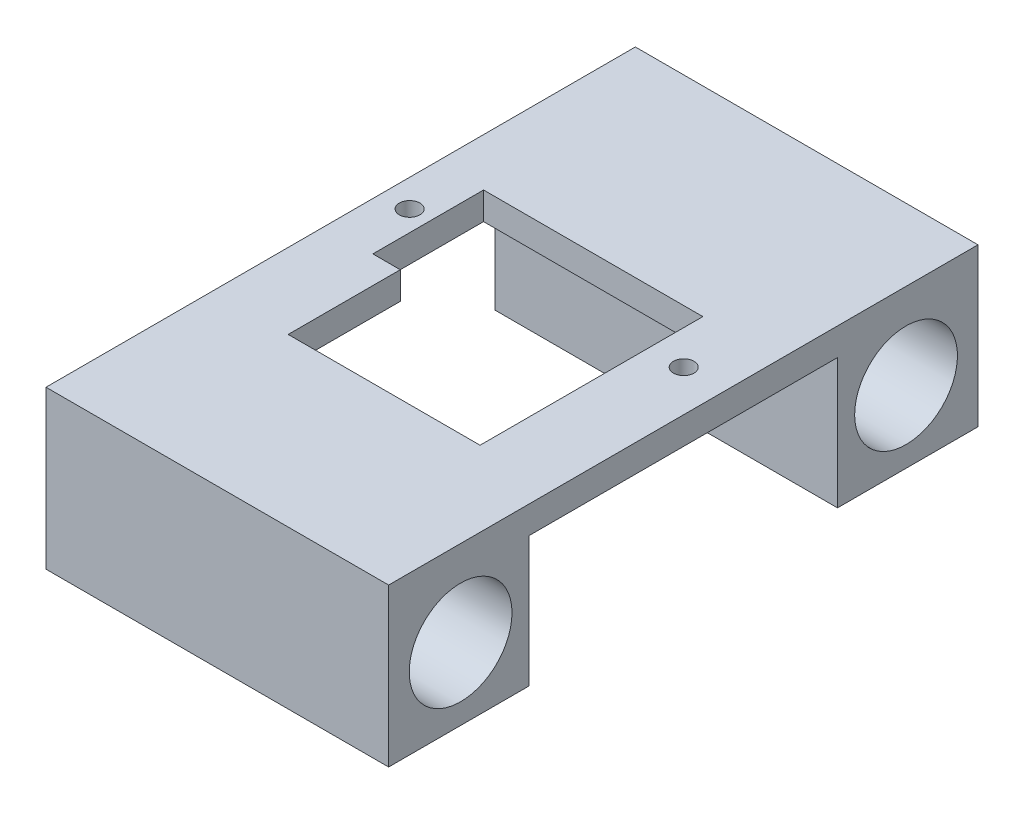
from build123d import *

# Parameters (mm, degrees)
SKETCH1_R           = 7.5
BOSS_EXTRUDE1_DEPTH = 25
CUT_EXTRUDE1_DEPTH  = 34
SKETCH3_W           = 45
SKETCH3_H           = 19
CUT_EXTRUDE2_DEPTH  = 62
SKETCH4_R           = 1.5
CUT_EXTRUDE3_DEPTH  = 62


with BuildPart() as part:
    # Sketch1 → Boss-Extrude1 (new, symmetric)
    with BuildSketch(Plane(origin=(0, 0, 0), x_dir=(0, 0, -1), z_dir=(1, 0, 0))):
        Polygon((-32.5, -10.5), (-43, -10.5), (-43, 12.5), (43, 12.5), (43, -10.5), align=None)
        with Locations((-32.5, 0)):
            Circle(SKETCH1_R, mode=Mode.SUBTRACT)
        with Locations(Location((32.5, 0, 0), (0, 0, 180))):
            Circle(SKETCH1_R, mode=Mode.SUBTRACT)
    extrude(amount=BOSS_EXTRUDE1_DEPTH, both=True)

    # Sketch2 → Cut-Extrude1 (cut)
    with BuildSketch(Plane.XZ.offset(10.5)):
        Polygon((14, -13.850798543), (-18, -13.850798543), (-18, 2.304286058), (-14, 2.304286058), (-14, 18.660685655), (14, 18.660685655), align=None)
    extrude(amount=-CUT_EXTRUDE1_DEPTH, mode=Mode.SUBTRACT)

    # Sketch3 → Cut-Extrude2 (cut)
    with BuildSketch(Plane.ZY.offset(25)):
        with Locations((0, -1)):
            Rectangle(SKETCH3_W, SKETCH3_H)
    extrude(amount=-CUT_EXTRUDE2_DEPTH, mode=Mode.SUBTRACT)

    # Sketch4 → Cut-Extrude3 (cut)
    with BuildSketch(Plane.XZ.offset(-8.5)):
        with Locations(Location((-21, -6.058605683, 0), (0, 0, 270))):
            Circle(SKETCH4_R)
        with Locations(Location((19, -6.058605683, 0), (0, 0, 270))):
            Circle(SKETCH4_R)
    extrude(amount=-CUT_EXTRUDE3_DEPTH, mode=Mode.SUBTRACT)


solid = part.part
